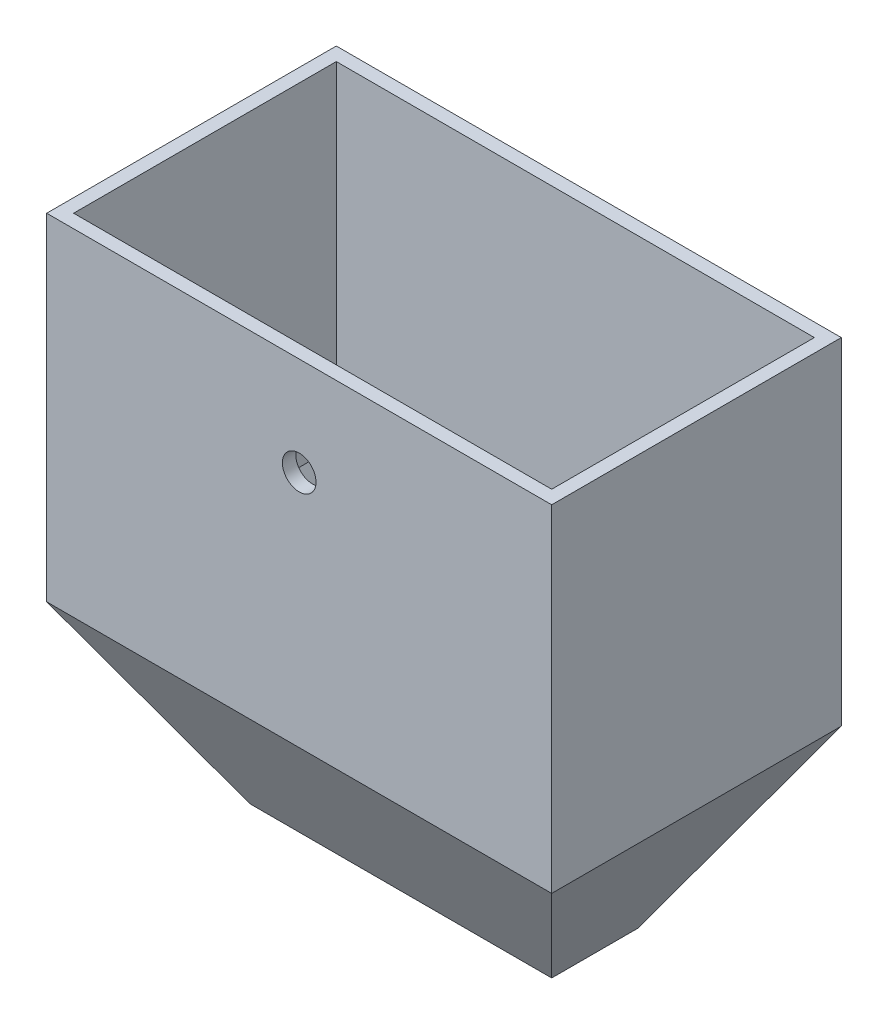
from build123d import *

# Parameters (mm, degrees)
SKETCH_1_W          = 375.14
SKETCH_1_H          = 215.14
EXTRUDE_1_DEPTH     = 250
SHELL_1_T           = -10
SKETCH_5_R          = 12.5
CUT_EXTRUDE_1_DEPTH = 10
SKETCH_6_W          = 214
SKETCH_6_H          = 54
CUT_EXTRUDE_2_DEPTH = 10


with BuildPart() as part:
    # 草图1 → 凸台-拉伸1 (new body)
    with BuildSketch(Plane(origin=(0, 0, 0), x_dir=(1, 0, 0), z_dir=(0, 1, 0))):
        Rectangle(SKETCH_1_W, SKETCH_1_H)
    extrude(amount=EXTRUDE_1_DEPTH)

    # 草图4 → section 1 of loft_1
    with BuildSketch(Plane(origin=(0, -130, 0), x_dir=(1, 0, 0), z_dir=(0, 1, 0)), mode=Mode.PRIVATE) as loft_1_s1:
        with BuildLine():
            Line((-112, 32), (112, 32))
            Line((112, 32), (112, -32))
            Line((112, -32), (-112, -32))
            Line((-112, -32), (-112, 32))
        make_face()
    # loft from a face of the part (loft_1)
    loft([part.faces().sort_by_distance((0, 0, 0))[0], loft_1_s1.sketch])

    # 抽壳1
    shell_1_openings = [part.faces().sort_by_distance(p)[0] for p in [
        (0, 250, 0),
    ]]
    offset(amount=SHELL_1_T, openings=shell_1_openings, kind=Kind.INTERSECTION)

    # 草图5 → 切除-拉伸1 (cut)
    with BuildSketch(Plane.XY.offset(107.57)):
        with Locations((0, 177)):
            Circle(SKETCH_5_R)
    extrude(amount=-CUT_EXTRUDE_1_DEPTH, mode=Mode.SUBTRACT)

    # 草图6 → 切除-拉伸2 (cut)
    with BuildSketch(Plane.XZ.offset(130)):
        Rectangle(SKETCH_6_W, SKETCH_6_H)
    extrude(amount=-CUT_EXTRUDE_2_DEPTH, mode=Mode.SUBTRACT)


solid = part.part
